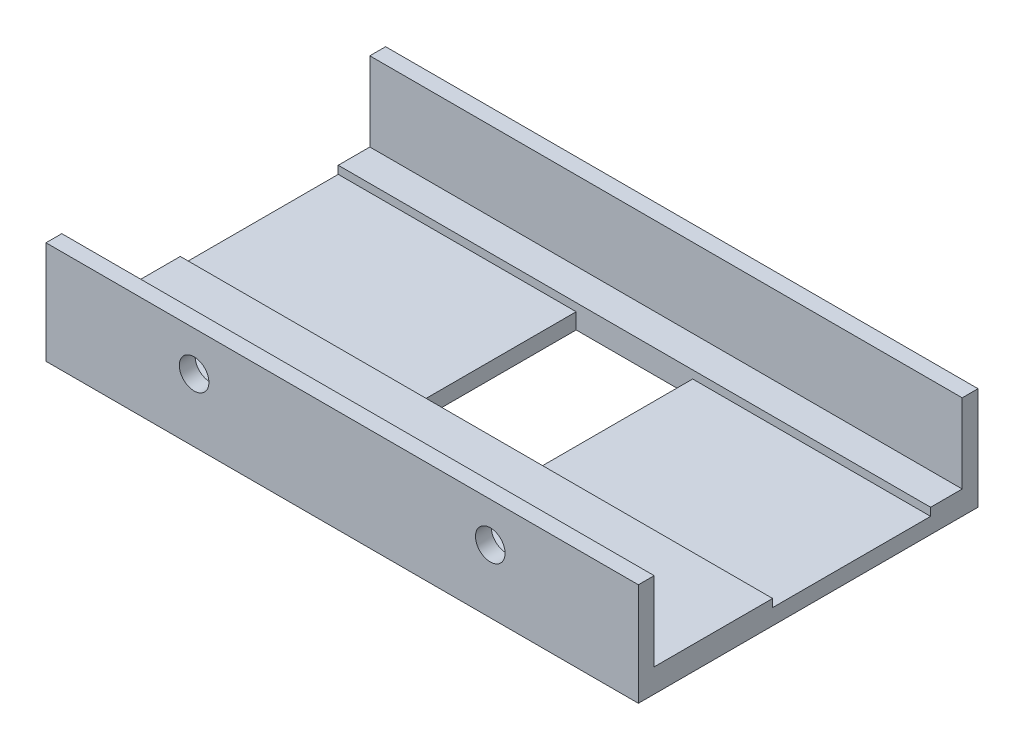
from build123d import *

# Parameters (mm, degrees)
SKETCH1_W           = 75
SKETCH1_H           = 43
BOSS_EXTRUDE1_DEPTH = 3
SKETCH2_W           = 75
SKETCH2_H           = 2
BOSS_EXTRUDE2_DEPTH = 10
SKETCH3_W           = 75
SKETCH3_H           = 2
BOSS_EXTRUDE3_DEPTH = 10
SKETCH4_OUTSIDE_W   = 94.484
SKETCH4_OUTSIDE_H   = 32.484
SKETCH4_OUTSIDE_W_2 = 79
SKETCH4_OUTSIDE_H_2 = 17
SKETCH4_OUTSIDE_R   = 1.875
CUT_EXTRUDE2_DEPTH  = 2
SKETCH6_W           = 14.75
SKETCH6_H           = 20
CUT_EXTRUDE3_DEPTH  = 45.367781103
SKETCH7_W           = 75
SKETCH7_H           = 20
CUT_EXTRUDE4_DEPTH  = 1


with BuildPart() as part:
    # Sketch1 → Boss-Extrude1 (new body)
    with BuildSketch(Plane(origin=(0, 0, 0), x_dir=(1, 0, 0), z_dir=(0, 1, 0))):
        Rectangle(SKETCH1_W, SKETCH1_H)
    extrude(amount=BOSS_EXTRUDE1_DEPTH)

    # Sketch2 → Boss-Extrude2 (add)
    with BuildSketch(Plane(origin=(0, 3, 0), x_dir=(1, 0, 0), z_dir=(0, 1, 0))):
        with Locations((0, 20.5)):
            Rectangle(SKETCH2_W, SKETCH2_H)
    extrude(amount=BOSS_EXTRUDE2_DEPTH)

    # Sketch3 → Boss-Extrude3 (add)
    with BuildSketch(Plane(origin=(0, 3, 0), x_dir=(1, 0, 0), z_dir=(0, 1, 0))):
        with Locations((0, -20.5)):
            Rectangle(SKETCH3_W, SKETCH3_H)
    extrude(amount=BOSS_EXTRUDE3_DEPTH)

    # Sketch4 outside → Cut-Extrude2 (cut)
    # profile 1 of 3: a face of its own
    with BuildSketch(Plane.XY.offset(21.5)):
        with Locations((0, 6.5)):
            Rectangle(SKETCH4_OUTSIDE_W, SKETCH4_OUTSIDE_H)
        with Locations((0, 6.5)):
            Rectangle(SKETCH4_OUTSIDE_W_2, SKETCH4_OUTSIDE_H_2, mode=Mode.SUBTRACT)
    # profile 2 of 3: a face of its own
    with BuildSketch(Plane.XY.offset(21.5)):
        with Locations((18.75, 8)):
            Circle(SKETCH4_OUTSIDE_R)
    # profile 3 of 3: a face of its own
    with BuildSketch(Plane.XY.offset(21.5)):
        with Locations((-18.75, 8)):
            Circle(SKETCH4_OUTSIDE_R)
    extrude(amount=-CUT_EXTRUDE2_DEPTH, mode=Mode.SUBTRACT)

    # Sketch6 → Cut-Extrude3 (cut, through all)
    with BuildSketch(Plane(origin=(0, 3, 0), x_dir=(1, 0, 0), z_dir=(0, 1, 0))):
        with Locations((0, 5.5)):
            Rectangle(SKETCH6_W, SKETCH6_H)
    extrude(amount=-CUT_EXTRUDE3_DEPTH, mode=Mode.SUBTRACT)

    # Sketch7 → Cut-Extrude4 (cut)
    with BuildSketch(Plane(origin=(0, 3, 0), x_dir=(1, 0, 0), z_dir=(0, 1, 0))):
        with Locations((0, 5.5)):
            Rectangle(SKETCH7_W, SKETCH7_H)
    extrude(amount=-CUT_EXTRUDE4_DEPTH, mode=Mode.SUBTRACT)


solid = part.part
